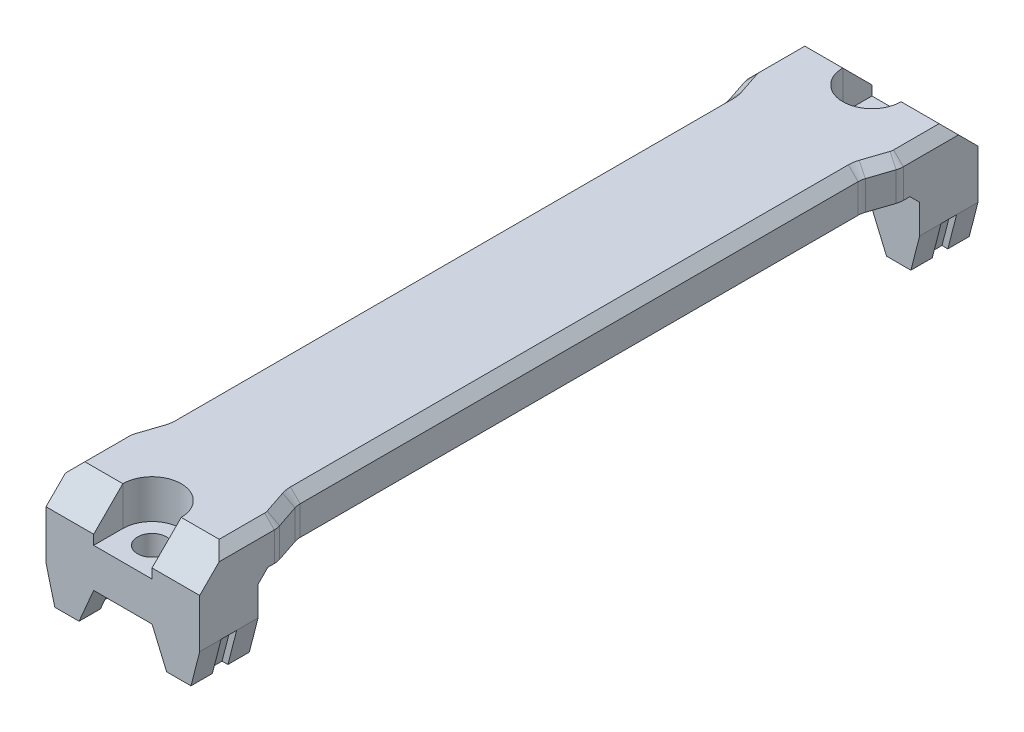
from build123d import *
from build123d.topology import SkipClean

# Parameters (mm, degrees)
EXTRUDE_1_DEPTH     = 4
EXTRUDE_3_DEPTH     = 6
CHAMFER_1_SIZE      = 3
CUT_EXTRUDE_2_DEPTH = 3.99
CUT_EXTRUDE_3_REACH = 51.222
SKETCH_7_R          = 1.5
SKETCH_8_R          = 6
EXTRUDE_4_DEPTH     = 1
FILLET_1_R          = 0.5
SKETCH_9_R          = 5
CUT_EXTRUDE_4_DEPTH = 3
SKETCH_10_R         = 3.55
CUT_EXTRUDE_5_DEPTH = 3.6
CUT_EXTRUDE_6_DEPTH = 0.8
CUT_EXTRUDE_7_DEPTH = 50.986598204
FILLET_2_R          = 2
CHAMFER_2_SIZE      = 1


with BuildPart() as part:
    # ｽｹｯﾁ1 → ﾎﾞｽ - 押し出し1 (new body)
    with BuildSketch(Plane(origin=(0, 0, 0), x_dir=(1, 0, 0), z_dir=(0, 1, 0))):
        with BuildLine():
            Line((-7.9, 0), (-7.9, -48))
            Line((-7.9, -48), (7.9, -48))
            Line((7.9, -48), (7.9, 0))
            ThreePointArc((7.9, 0), (0, 7.9), (-7.9, 0))
        make_face()
    extrude(amount=EXTRUDE_1_DEPTH)

    # ｽｹｯﾁ4 → ﾎﾞｽ - 押し出し3 (add)
    with BuildSketch(Plane.XY.offset(48)):
        Polygon((-7, -7.5), (-4.5, -7.5), (-3, -4), (3, -4), (4.5, -7.5), (7, -7.5), (7.9, -4), (7.9, 0), (-7.9, 0), (-7.9, -4), align=None)
    extrude(amount=-EXTRUDE_3_DEPTH)

    # 面取り1
    chamfer_1_edges = [part.edges().sort_by_distance(p)[0] for p in [
        (0, 4, 48),
    ]]
    chamfer(chamfer_1_edges, length=CHAMFER_1_SIZE)

    # ｽｹｯﾁ6 → ｶｯﾄ - 押し出し2 (cut)
    with BuildSketch(Plane(origin=(0, 4, 0), x_dir=(1, 0, 0), z_dir=(0, 1, 0))):
        with BuildLine():
            Line((-3, -45), (-3, -49))
            Line((-3, -49), (3, -49))
            Line((3, -49), (3, -45))
            ThreePointArc((3, -45), (0, -42), (-3, -45))
        make_face()
    extrude(amount=-CUT_EXTRUDE_2_DEPTH, mode=Mode.SUBTRACT)

    # ｽｹｯﾁ7 → ｶｯﾄ - 押し出し3 (cut, up to next)
    with BuildSketch(Plane(origin=(0, 0.01, 0), x_dir=(1, 0, 0), z_dir=(0, 1, 0)), mode=Mode.PRIVATE) as cut_extrude_3_sk1:
        with Locations(Location((0, -45, 0), (0, 0, 270))):
            Circle(SKETCH_7_R)
    cut_extrude_3_tool1 = extrude(cut_extrude_3_sk1.sketch, amount=-CUT_EXTRUDE_3_REACH, mode=Mode.PRIVATE) & part.part
    add(cut_extrude_3_tool1.solids().sort_by_distance((0, 0.01, 45))[0], mode=Mode.SUBTRACT)

    # ｽｹｯﾁ8 → ﾎﾞｽ - 押し出し4 (add)
    with BuildSketch(Plane.XZ):
        with Locations(Location((0, 0, 0), (0, 0, 90))):
            Circle(SKETCH_8_R)
    extrude(amount=EXTRUDE_4_DEPTH)

    # ﾌｨﾚｯﾄ1
    fillet_1_edges = [part.edges().sort_by_distance(p)[0] for p in [
        (0, 0, -6),
    ]]
    fillet(fillet_1_edges, radius=FILLET_1_R)

    # ｽｹｯﾁ9 → ｶｯﾄ - 押し出し4 (cut)
    with BuildSketch(Plane(origin=(0, 4, 0), x_dir=(1, 0, 0), z_dir=(0, 1, 0))):
        with Locations(Location((0, 0, 0), (0, 0, 270))):
            Circle(SKETCH_9_R)
    extrude(amount=-CUT_EXTRUDE_4_DEPTH, mode=Mode.SUBTRACT)

    # ｽｹｯﾁ10 → ｶｯﾄ - 押し出し5 (cut)
    with BuildSketch(Plane(origin=(0, 1, 0), x_dir=(1, 0, 0), z_dir=(0, 1, 0))):
        with Locations(Location((0, 0, 0), (0, 0, 270))):
            Circle(SKETCH_10_R)
    extrude(amount=-CUT_EXTRUDE_5_DEPTH, mode=Mode.SUBTRACT)

    # ｽｹｯﾁ11 → ｶｯﾄ - 押し出し6 (cut, symmetric)
    with BuildSketch(Plane.XY.offset(45)):
        Polygon((3, -4), (4.5, -7.5), (5.1, -7.5), (3.6, -4), align=None)
        Polygon((6.4, -7.5), (7, -7.5), (7.9, -4), (7.3, -4), align=None)
    cut_extrude_6 = extrude(amount=CUT_EXTRUDE_6_DEPTH, both=True, mode=Mode.SUBTRACT)

    # ﾐﾗｰ1: ｶｯﾄ - 押し出し6 across plane
    add(cut_extrude_6.mirror(Plane(origin=(0, 0, 0), x_dir=(0, 0, 1), z_dir=(1, 0, 0))), mode=Mode.SUBTRACT)

    # ｽｹｯﾁ12 → ｶｯﾄ - 押し出し7 (cut, through all)
    with SkipClean():  # the faces are left unmerged after this step: merging them gives an invalid solid
        with BuildSketch(Plane(origin=(0, 4, 0), x_dir=(1, 0, 0), z_dir=(0, 1, 0))):
            with BuildLine():
                Line((-7.9, 0), (-7.9, -40))
                Line((-7.9, -40), (-6.9, -37))
                Line((-6.9, -37), (-6.9, -3.847076812))
                ThreePointArc((-6.9, -3.847076812), (-7.645913941, -1.987460691), (-7.9, 0))
            make_face()
        cut_extrude_7 = extrude(amount=-CUT_EXTRUDE_7_DEPTH, mode=Mode.SUBTRACT)

    # ﾐﾗｰ2: ｶｯﾄ - 押し出し7 across plane
    with SkipClean():  # the faces are left unmerged after this step: merging them gives an invalid solid
        add(cut_extrude_7.mirror(Plane(origin=(0, 0, 0), x_dir=(0, 0, 1), z_dir=(1, 0, 0))), mode=Mode.SUBTRACT)

    # ﾌｨﾚｯﾄ2
    fillet_2_edges = [part.edges().sort_by_distance(p)[0] for p in [
        (-6.9, 2, 3.847076812),
        (-6.9, 2, 37),
        (-7.9, 2, 40),
        (6.9, 2, 3.847076812),
        (7.9, 2, 40),
        (6.9, 2, 37),
    ]]
    fillet(fillet_2_edges, radius=FILLET_2_R)

    # 面取り2
    chamfer_2_edges = [part.edges().sort_by_distance(p)[0] for p in [
        (-7.9, 4, 42.66227766),
        (0, 4, -7.9),
        (7.9, 4, 42.66227766),
        (0, 0, 42),
        (-7.874174915, 4, 40.004190834),
        (-7.4, 4, 38.5),
        (-6.925825085, 4, 36.995809166),
        (-6.9, 4, 20.505670679),
        (-6.951159371, 4, 3.886430103),
        (6.951159371, 4, 3.886430103),
        (6.9, 4, 20.505670679),
        (6.925825085, 4, 36.995809166),
        (7.4, 4, 38.5),
        (7.874174915, 4, 40.004190834),
    ]]
    chamfer(chamfer_2_edges, length=CHAMFER_2_SIZE)

    # Surface Cut 1
    split(bisect_by=Plane.XY.offset(8), keep=Keep.TOP)

    # ﾐﾗｰ4: part across plane


with BuildPart() as part_1:
    add(part.part)
    add(part.part.mirror(Plane.XY.offset(8)))


solid = part_1.part
